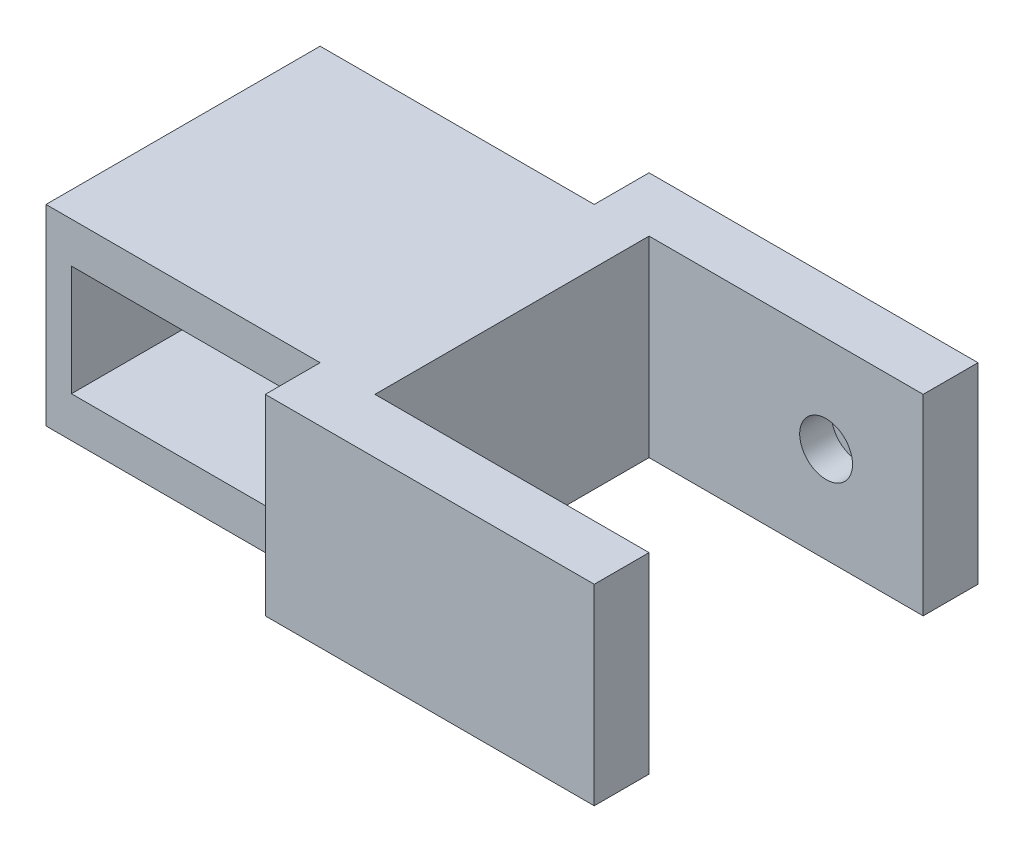
from build123d import *

# Parameters (mm, degrees)
SKETCH2_W           = 50
SKETCH2_H           = 35
BOSS_EXTRUDE1_DEPTH = 50
SKETCH3_W           = 40.72
SKETCH3_H           = 20.17
CUT_EXTRUDE1_DEPTH  = 28.82
BOSS_EXTRUDE2_DEPTH = 35
SKETCH5_R           = 4.817251836
CUT_EXTRUDE2_DEPTH  = 5.82


with BuildPart() as part:
    # Sketch2 → Boss-Extrude1 (new body)
    with BuildSketch(Plane.XY):
        Rectangle(SKETCH2_W, SKETCH2_H)
    extrude(amount=BOSS_EXTRUDE1_DEPTH)

    # Sketch3 → Cut-Extrude1 (cut)
    with BuildSketch(Plane.XY.offset(50)):
        Rectangle(SKETCH3_W, SKETCH3_H)
    extrude(amount=-CUT_EXTRUDE1_DEPTH, mode=Mode.SUBTRACT)

    # Sketch4 → Boss-Extrude2 (add)
    with BuildSketch(Plane(origin=(0, 17.5, 0), x_dir=(1, 0, 0), z_dir=(0, 1, 0))):
        Polygon((25, -50), (25, 0), (25, 10), (85, 10), (85, 0), (35, 0), (35, -50), (85, -50), (85, -60), (25, -60), align=None)
    extrude(amount=-BOSS_EXTRUDE2_DEPTH)

    # Sketch5 → Cut-Extrude2 (cut)
    with BuildSketch(Plane.XY):
        with Locations((67.294168967, 0)):
            Circle(SKETCH5_R)
    extrude(amount=-CUT_EXTRUDE2_DEPTH, mode=Mode.SUBTRACT)


solid = part.part
